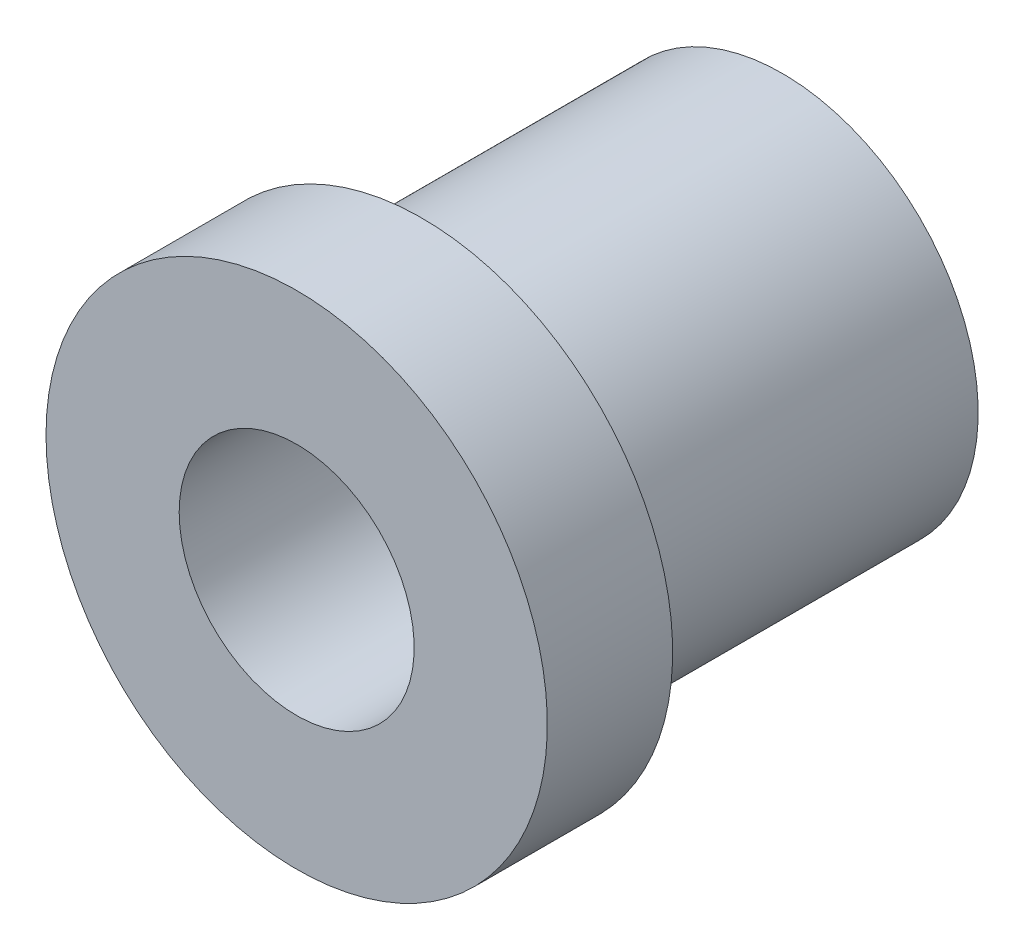
from build123d import *


with BuildPart() as part:
    # Skizze1 → Rotation1 (revolve)
    with BuildSketch(Plane(origin=(0, 0, 0), x_dir=(1, 0, 0), z_dir=(0, 1, 0))):
        Polygon((-16, -0.003845877), (-7.5, -0.003845877), (-7.5, 30.996154123), (-12.5, 30.996154123), (-12.5, 7.996154123), (-16, 7.996154123), align=None)
        Polygon((7.5, 30.996154123), (7.5, -0.003845877), (16, -0.003845877), (16, 7.996154123), (12.5, 7.996154123), (12.5, 30.996154123), align=None)
    revolve(axis=Axis((0, 0, -31.818426175), (0, 0, 1)))


solid = part.part
